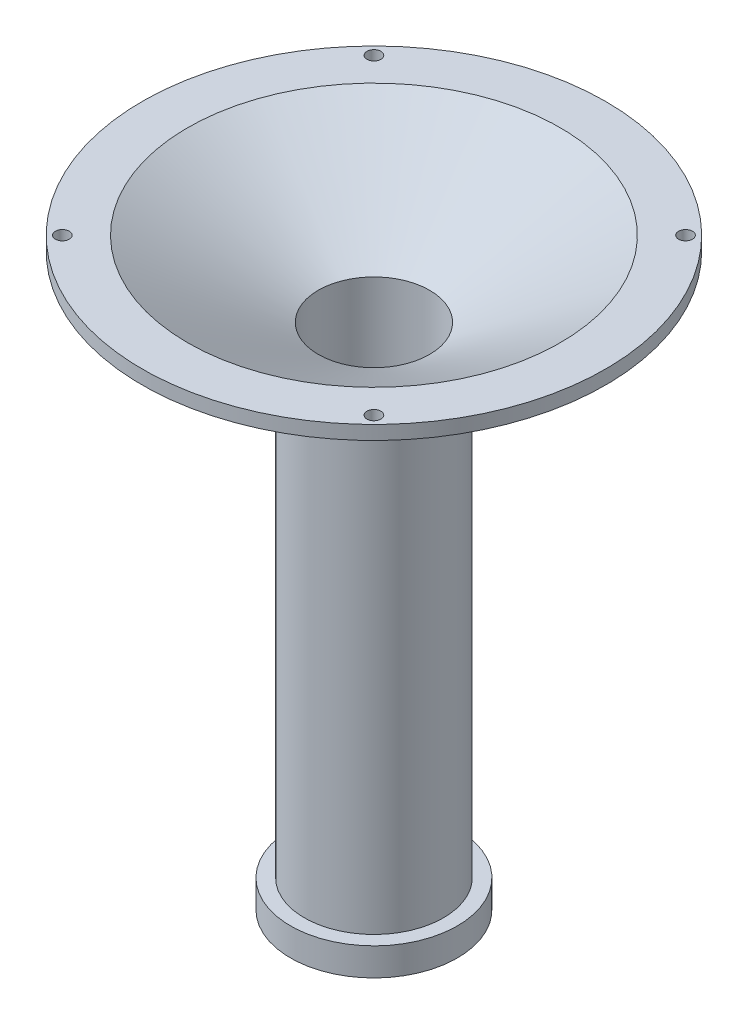
from build123d import *

# Parameters (mm, degrees)
M6_TAPPED_HOLE1_D = 5


with BuildPart() as part:
    # Sketch1 → Revolve1 (revolve)
    with BuildSketch(Plane.XY, mode=Mode.PRIVATE) as revolve1_sk:
        Polygon((20, -121.747729768), (20, 61.139021578), (66.961524227, 88.252270232), (83.301270189, 88.252270232), (83.301270189, 83.252270232), (68.301270189, 83.252270232), (25, 58.252270232), (25, -111.747729768), (30, -111.747729768), (30, -121.747729768), (25, -121.747729768), align=None)
    revolve(revolve1_sk.sketch.rotate(Axis((0, 0, 0), (0, 1, 0)), 90), axis=Axis((0, 0, 0), (0, 1, 0)))

    # M6 Tapped Hole1 (through all)
    with Locations(Plane(origin=(-56, 88.252270232, -56), x_dir=(0, 0, 1), z_dir=(0, 1, 0))):
        with Locations((0, 0), (0, 112), (112, 0), (112, 112)):
            Hole(M6_TAPPED_HOLE1_D / 2)


solid = part.part
